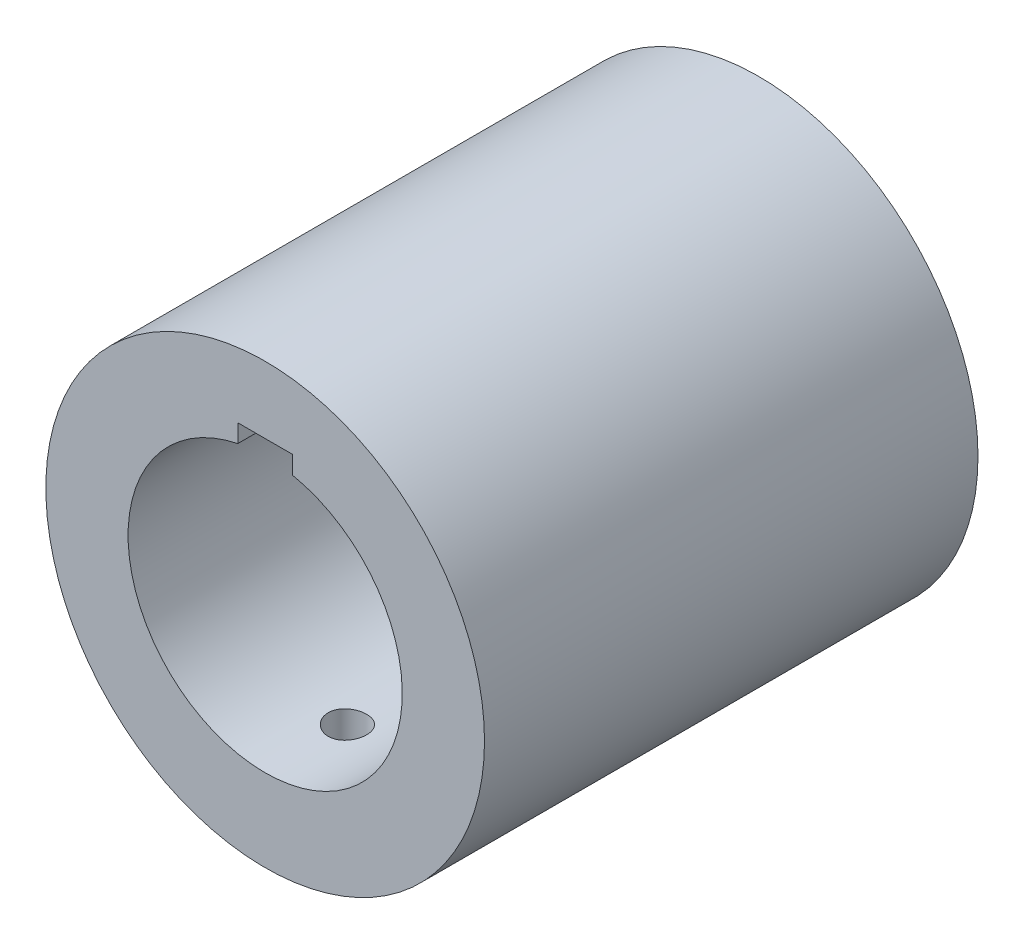
from build123d import *

# Parameters (mm, degrees)
SKETCH1_R           = 40
BOSS_EXTRUDE1_DEPTH = 45
SKETCH2_R           = 25
CUT_EXTRUDE1_DEPTH  = 50
SKETCH3_W           = 45
SKETCH3_H           = 45
CUT_EXTRUDE2_DEPTH  = 40
SKETCH4_W           = 10
SKETCH4_H           = 12
CUT_EXTRUDE3_DEPTH  = 40
SKETCH5_R           = 3.5
CUT_EXTRUDE4_DEPTH  = 30


with BuildPart() as part:
    # Sketch1 → Boss-Extrude1 (new, symmetric)
    with BuildSketch(Plane.XY):
        with Locations(Location((0, 0, 0), (0, 0, 180))):
            Circle(SKETCH1_R)
    extrude(amount=BOSS_EXTRUDE1_DEPTH, both=True)

    # Sketch2 → Cut-Extrude1 (cut)
    with BuildSketch(Plane.XY.offset(45)):
        Circle(SKETCH2_R)
    extrude(amount=-CUT_EXTRUDE1_DEPTH, mode=Mode.SUBTRACT)

    # Sketch3 → Cut-Extrude2 (cut)
    with BuildSketch(Plane(origin=(0, 0, -45), x_dir=(-1, 0, 0), z_dir=(0, 0, -1))):
        Rectangle(SKETCH3_W, SKETCH3_H)
    extrude(amount=-CUT_EXTRUDE2_DEPTH, mode=Mode.SUBTRACT)

    # Sketch4 → Cut-Extrude3 (cut)
    with BuildSketch(Plane.XY.offset(45)):
        with Locations((0, 21.79)):
            Rectangle(SKETCH4_W, SKETCH4_H)
    extrude(amount=-CUT_EXTRUDE3_DEPTH, mode=Mode.SUBTRACT)

    # Sketch5 → Cut-Extrude4 (cut)
    with BuildSketch(Plane(origin=(0, -40, 45), x_dir=(-1, 0, 0), z_dir=(0, -1, 0))):
        with Locations(Location((0, 15, 0), (0, 0, 180))):
            Circle(SKETCH5_R)
        with Locations(Location((0, 75, 0), (0, 0, 180))):
            Circle(SKETCH5_R)
    extrude(amount=-CUT_EXTRUDE4_DEPTH, mode=Mode.SUBTRACT)


solid = part.part
